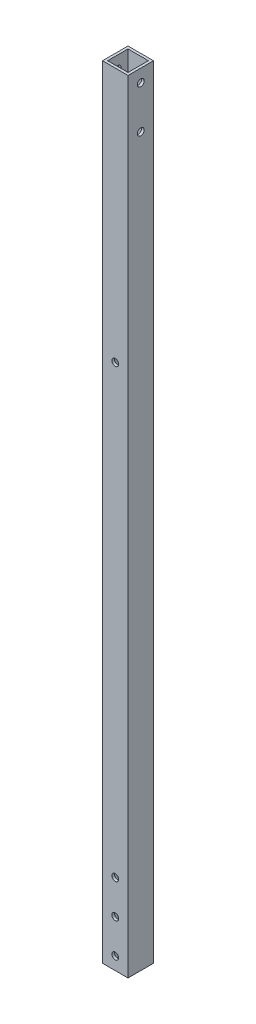
from build123d import *

# Parameters (mm, degrees)
SKETCH_1_W          = 15
SKETCH_1_H          = 15
SKETCH_1_W_2        = 12
SKETCH_1_H_2        = 12
EXTRUDE_1_DEPTH     = 460
SKETCH_2_R          = 2
CUT_EXTRUDE_1_DEPTH = 461.305605006
SKETCH_3_R          = 2
CUT_EXTRUDE_2_DEPTH = 461.305605006


with BuildPart() as part:
    # ｽｹｯﾁ1 → 押し出し-薄板1 (new body)
    with BuildSketch(Plane(origin=(0, 0, 0), x_dir=(1, 0, 0), z_dir=(0, 1, 0))):
        Rectangle(SKETCH_1_W, SKETCH_1_H)
        Rectangle(SKETCH_1_W_2, SKETCH_1_H_2, mode=Mode.SUBTRACT)
    extrude(amount=EXTRUDE_1_DEPTH)

    # ｽｹｯﾁ2 → ｶｯﾄ - 押し出し1 (cut, through all)
    with BuildSketch(Plane(origin=(7.5, 0, 0), x_dir=(0, 0, -1), z_dir=(1, 0, 0))):
        with Locations((0, 452.5)):
            Circle(SKETCH_2_R)
        with Locations((0, 427.5)):
            Circle(SKETCH_2_R)
    extrude(amount=-CUT_EXTRUDE_1_DEPTH, mode=Mode.SUBTRACT)

    # ｽｹｯﾁ3 → ｶｯﾄ - 押し出し2 (cut, through all)
    with BuildSketch(Plane.XY.offset(7.5)):
        with Locations((0, 7.5)):
            Circle(SKETCH_3_R)
        with Locations((0, 47.5)):
            Circle(SKETCH_3_R)
        with Locations((0, 27.5)):
            Circle(SKETCH_3_R)
        with Locations((0, 310)):
            Circle(SKETCH_3_R)
    extrude(amount=-CUT_EXTRUDE_2_DEPTH, mode=Mode.SUBTRACT)


solid = part.part
